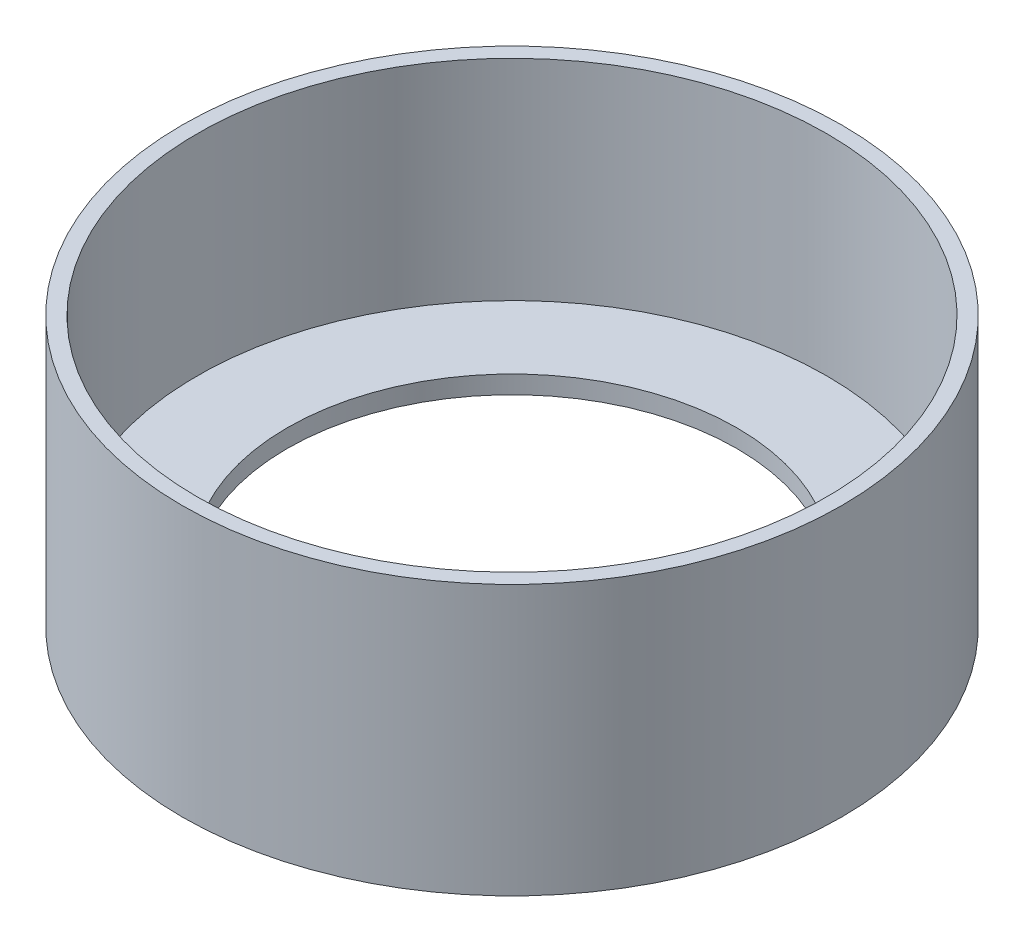
from build123d import *

# Parameters (mm, degrees)
BOSS_EXTRUDE1_DEPTH      = 70
BOSS_EXTRUDE1_DEPTH_BACK = 20
SKETCH1_R                = 120
SKETCH1_R_2              = 105
SKETCH2_R                = 105
SKETCH2_R_2              = 75
BOSS_EXTRUDE2_DEPTH      = 6
SKETCH3_R                = 120
SKETCH3_R_2              = 115
CUT_EXTRUDE1_DEPTH       = 193.093727123
SKETCH4_R                = 120
SKETCH4_R_2              = 110
CUT_EXTRUDE2_DEPTH       = 186.876302954


with BuildPart() as part:
    # Sketch1 → Boss-Extrude1 (new, two sides: drawn at the far end of the back side and taken through both)
    with BuildSketch(Plane(origin=(0, 0, 0), x_dir=(1, 0, 0), z_dir=(0, 1, 0)).offset(-BOSS_EXTRUDE1_DEPTH_BACK)):
        with Locations(Location((0, 0, 0), (0, 0, 270))):
            Circle(SKETCH1_R)
        with Locations(Location((0, 0, 0), (0, 0, 270))):
            Circle(SKETCH1_R_2, mode=Mode.SUBTRACT)
    extrude(amount=BOSS_EXTRUDE1_DEPTH + BOSS_EXTRUDE1_DEPTH_BACK)

    # Sketch2 → Boss-Extrude2 (add)
    with BuildSketch(Plane(origin=(0, 0, 0), x_dir=(1, 0, 0), z_dir=(0, 1, 0))):
        with Locations(Location((0, 0, 0), (0, 0, 270))):
            Circle(SKETCH2_R)
        with Locations(Location((0, 0, 0), (0, 0, 270))):
            Circle(SKETCH2_R_2, mode=Mode.SUBTRACT)
    extrude(amount=-BOSS_EXTRUDE2_DEPTH)

    # Sketch3 → Cut-Extrude1 (cut, through all)
    with BuildSketch(Plane(origin=(0, 70, 0), x_dir=(1, 0, 0), z_dir=(0, 1, 0))):
        Circle(SKETCH3_R)
        with Locations(Location((0, 0, 0), (0, 0, 270))):
            Circle(SKETCH3_R_2, mode=Mode.SUBTRACT)
    extrude(amount=-CUT_EXTRUDE1_DEPTH, mode=Mode.SUBTRACT)

    # Sketch4 → Cut-Extrude2 (cut, through all)
    with BuildSketch(Plane(origin=(0, 70, 0), x_dir=(1, 0, 0), z_dir=(0, 1, 0))):
        Circle(SKETCH4_R)
        with Locations(Location((0, 0, 0), (0, 0, 270))):
            Circle(SKETCH4_R_2, mode=Mode.SUBTRACT)
    extrude(amount=-CUT_EXTRUDE2_DEPTH, mode=Mode.SUBTRACT)


solid = part.part
